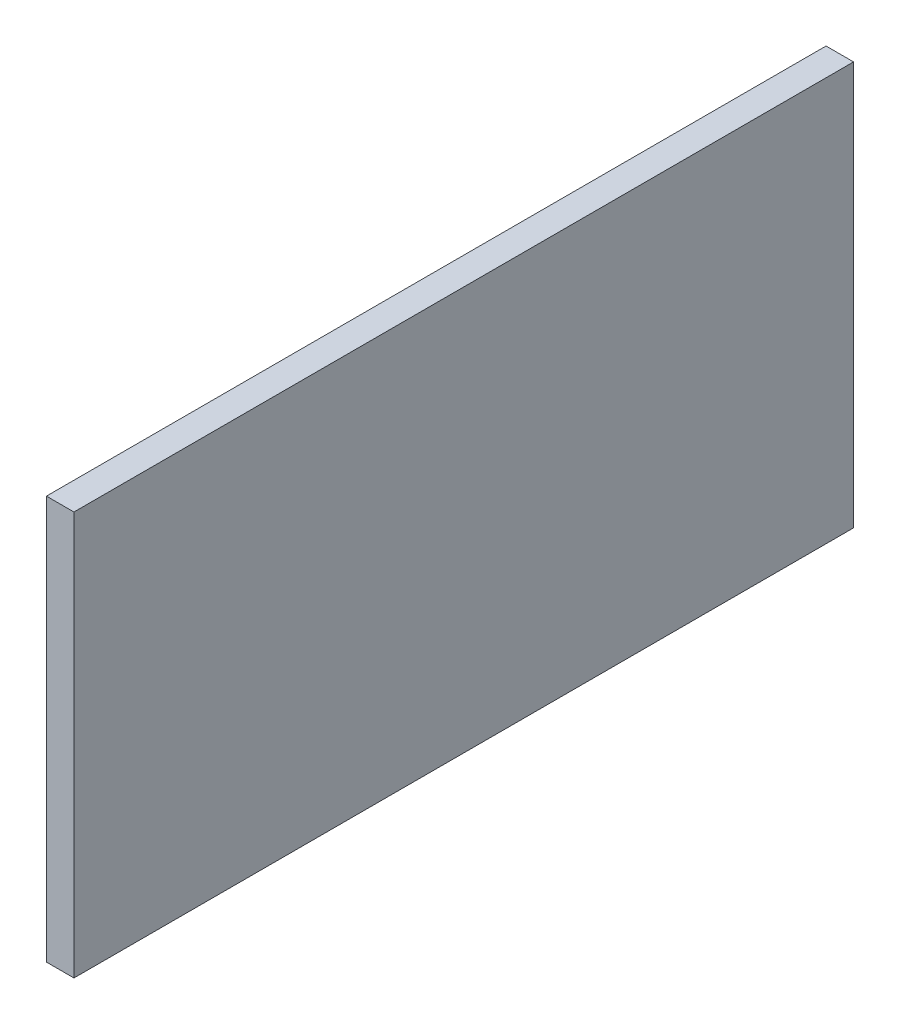
from build123d import *

# Parameters (mm, degrees)
BOSS_EXTRUDE1_START = 123.5
SKETCH1_W           = 85
SKETCH1_H           = 44
BOSS_EXTRUDE1_DEPTH = 1.5
BOSS_EXTRUDE2_START = 14.1
SKETCH2_R           = 6.5
BOSS_EXTRUDE2_DEPTH = 2.1
BOSS_EXTRUDE3_START = 14.1
SKETCH3_W           = 14.3
SKETCH3_H           = 13
BOSS_EXTRUDE3_DEPTH = 2.1
CUT_EXTRUDE1_START  = 14.1
SKETCH4_R           = 3.55
CUT_EXTRUDE1_DEPTH  = 2.1
CUT_EXTRUDE2_START  = 14.1
CUT_EXTRUDE2_DEPTH  = 2.1
BOSS_EXTRUDE4_START = -24.5
SKETCH6_R           = 6.5
BOSS_EXTRUDE4_DEPTH = 1.5
BOSS_EXTRUDE5_START = -24.5
SKETCH7_W           = 14.3
SKETCH7_H           = 13
BOSS_EXTRUDE5_DEPTH = 1.5
CUT_EXTRUDE3_START  = -24.5
SKETCH8_R           = 2.95
CUT_EXTRUDE3_DEPTH  = 1.5


with BuildPart() as part:
    # Sketch1 → Boss-Extrude1 (new, symmetric)
    with BuildSketch(Plane(origin=(0, 0, 0), x_dir=(0, 0, -1), z_dir=(1, 0, 0)).offset(BOSS_EXTRUDE1_START)):
        with Locations((-4.5, 24)):
            Rectangle(SKETCH1_W, SKETCH1_H)
    extrude(amount=BOSS_EXTRUDE1_DEPTH, both=True)



with BuildPart() as body_2:
    # Sketch2 → Boss-Extrude2 (new, symmetric)
    with BuildSketch(Plane.XY.offset(BOSS_EXTRUDE2_START)):
        with Locations((108.2, 18.5)):
            Circle(SKETCH2_R)
    extrude(amount=BOSS_EXTRUDE2_DEPTH, both=True)


with BuildPart() as part_1:
    add(part.part)

    add(body_2.part)  # Boss-Extrude3 merges body 2
    # Sketch3 → Boss-Extrude3 (add, symmetric)
    with BuildSketch(Plane.XY.offset(BOSS_EXTRUDE3_START)):
        with Locations((115.35, 18.5)):
            Rectangle(SKETCH3_W, SKETCH3_H)
    extrude(amount=BOSS_EXTRUDE3_DEPTH, both=True)

    # Sketch4 → Cut-Extrude1 (cut, symmetric)
    with BuildSketch(Plane.XY.offset(CUT_EXTRUDE1_START)):
        with Locations((108.2, 18.5)):
            Circle(SKETCH4_R)
    extrude(amount=CUT_EXTRUDE1_DEPTH, both=True, mode=Mode.SUBTRACT)

    # Sketch5 → Cut-Extrude2 (cut, symmetric)
    with BuildSketch(Plane.XY.offset(CUT_EXTRUDE2_START)):
        Polygon((108.2, 14.95), (120.9, 16.096718595), (120.9, 20.903281405), (108.2, 22.05), align=None)
    extrude(amount=CUT_EXTRUDE2_DEPTH, both=True, mode=Mode.SUBTRACT)



with BuildPart() as body_2_2:
    # Sketch6 → Boss-Extrude4 (new, symmetric)
    with BuildSketch(Plane.XY.offset(BOSS_EXTRUDE4_START)):
        with Locations(Location((108.2, 18.5, 0), (0, 0, 180))):
            Circle(SKETCH6_R)
    extrude(amount=BOSS_EXTRUDE4_DEPTH, both=True)


with BuildPart() as part_2:
    add(part_1.part)

    add(body_2_2.part)  # Boss-Extrude5 merges body 2 2
    # Sketch7 → Boss-Extrude5 (add, symmetric)
    with BuildSketch(Plane.XY.offset(BOSS_EXTRUDE5_START)):
        with Locations((115.35, 18.5)):
            Rectangle(SKETCH7_W, SKETCH7_H)
    extrude(amount=BOSS_EXTRUDE5_DEPTH, both=True)

    # Sketch8 → Cut-Extrude3 (cut, symmetric)
    with BuildSketch(Plane.XY.offset(CUT_EXTRUDE3_START)):
        with Locations((108.2, 18.5)):
            Circle(SKETCH8_R)
    extrude(amount=CUT_EXTRUDE3_DEPTH, both=True, mode=Mode.SUBTRACT)


solid = part_2.part
